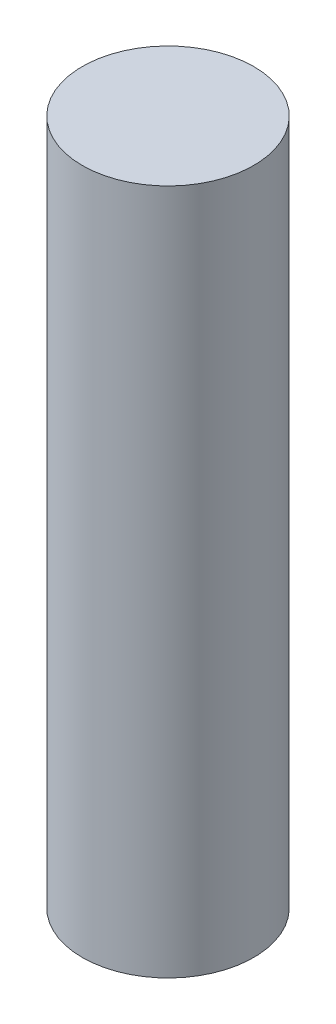
from build123d import *

# Parameters (mm, degrees)
BOSS_EXTRUDE1_DEPTH      = 20
BOSS_EXTRUDE1_DEPTH_BACK = 20
SKETCH1_R                = 5


with BuildPart() as part:
    # Sketch1 → Boss-Extrude1 (new, two sides: drawn at the far end of the back side and taken through both)
    with BuildSketch(Plane(origin=(0, 0, 0), x_dir=(1, 0, 0), z_dir=(0, 1, 0)).offset(-BOSS_EXTRUDE1_DEPTH_BACK)):
        with Locations(Location((0, 0, 0), (0, 0, 270))):
            Circle(SKETCH1_R)
    extrude(amount=BOSS_EXTRUDE1_DEPTH + BOSS_EXTRUDE1_DEPTH_BACK)


solid = part.part
